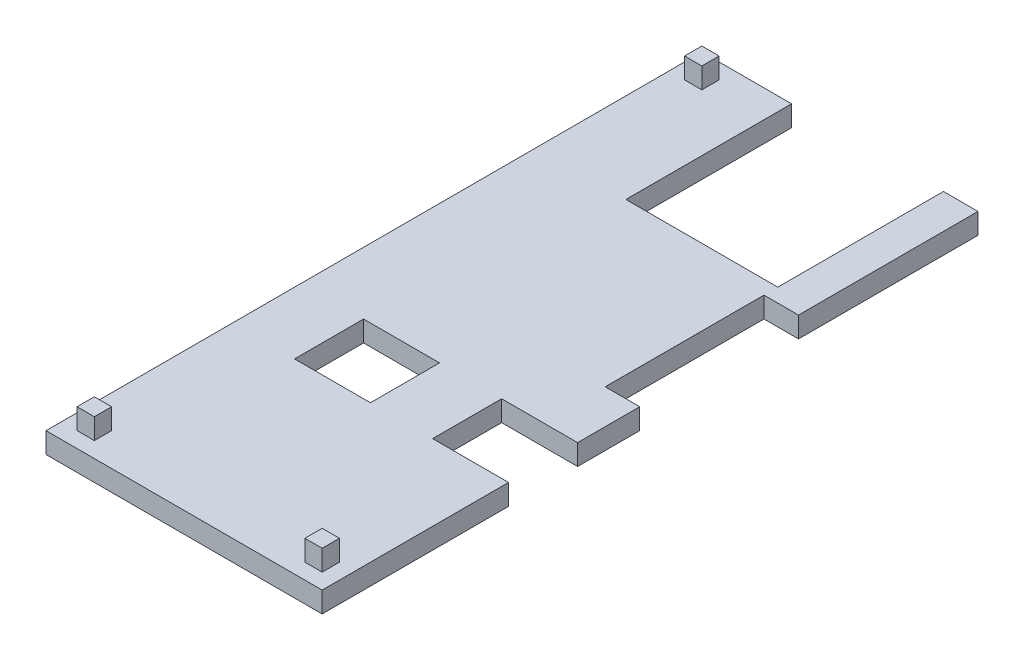
from build123d import *

# Parameters (mm, degrees)
SKETCH1_W               = 40
SKETCH1_H               = 95
BOSS_EXTRUDE1_DEPTH     = 3
SKETCH2_W               = 2.5
SKETCH2_H               = 2.5
BOSS_EXTRUDE2_DEPTH     = 3
CUT_EXTRUDE1_DEPTH      = 104.121287812
CUT_EXTRUDE1_DEPTH_BACK = 104.121287812
SKETCH3_W               = 22
SKETCH3_H               = 24
SKETCH3_W_2             = 5
SKETCH3_H_2             = 23
SKETCH3_W_3             = 11
SKETCH3_H_3             = 10


with BuildPart() as part:
    # Sketch1 → Boss-Extrude1 (new body)
    with BuildSketch(Plane(origin=(0, 0, 0), x_dir=(1, 0, 0), z_dir=(0, 1, 0))):
        with Locations((-20, 47.5)):
            Rectangle(SKETCH1_W, SKETCH1_H)
    extrude(amount=BOSS_EXTRUDE1_DEPTH)

    # Sketch2 → Boss-Extrude2 (add)
    with BuildSketch(Plane(origin=(0, 3, 0), x_dir=(1, 0, 0), z_dir=(0, 1, 0))):
        with Locations((-3.5, 3.5)):
            Rectangle(SKETCH2_W, SKETCH2_H)
        with Locations((-36.5, 3.5)):
            Rectangle(SKETCH2_W, SKETCH2_H)
        with Locations((-36.5, 91.5)):
            Rectangle(SKETCH2_W, SKETCH2_H)
    extrude(amount=BOSS_EXTRUDE2_DEPTH)

    # Sketch3 → Cut-Extrude1 (cut, two sides: drawn at the far end of the back side and taken through both)
    with BuildSketch(Plane(origin=(0, 3, 0), x_dir=(1, 0, 0), z_dir=(0, 1, 0)).offset(-CUT_EXTRUDE1_DEPTH_BACK)):
        with Locations((-16, 83)):
            Rectangle(SKETCH3_W, SKETCH3_H)
        with Locations((-2.5, 57.5)):
            Rectangle(SKETCH3_W_2, SKETCH3_H_2)
        with Locations((-5.5, 32)):
            Rectangle(SKETCH3_W_3, SKETCH3_H_3)
        with Locations((-25.5, 32)):
            Rectangle(SKETCH3_W_3, SKETCH3_H_3)
    extrude(amount=CUT_EXTRUDE1_DEPTH + CUT_EXTRUDE1_DEPTH_BACK, mode=Mode.SUBTRACT)


solid = part.part
